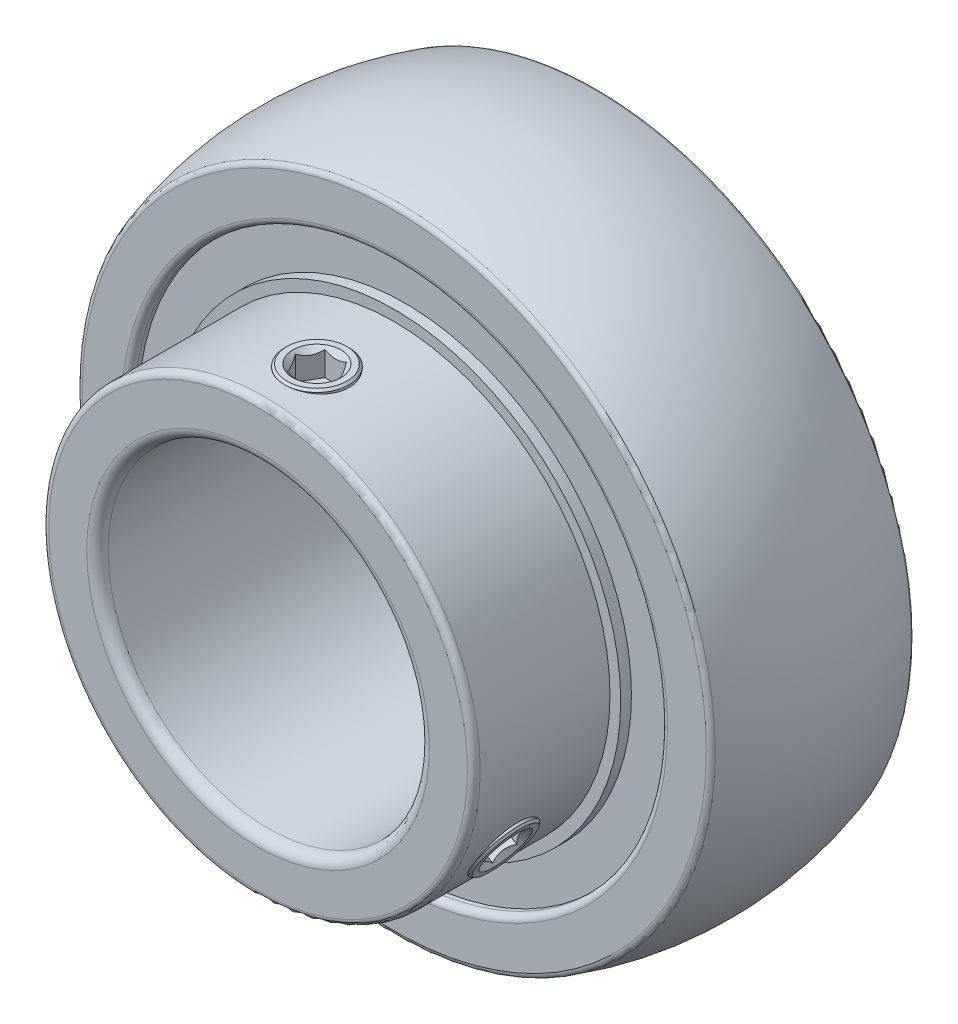
from build123d import *

# Parameters (mm, degrees)
ESBO_O1_W             = 16
ESBO_O1_H             = 4.76
ESBO_O2_R             = 3
CORTE_EXTRUS_O1_DEPTH = 50.150060066
CORTE_EXTRUS_O2_DEPTH = 2.5
PADR_OCIRCULAR1_COUNT = 2
PADR_OCIRCULAR1_ANGLE = 120


with BuildPart() as part:
    # Esboço1 → Revolução1 (revolve)
    with BuildSketch(Plane(origin=(0, 0, 0), x_dir=(0, 0, -1), z_dir=(1, 0, 0)), mode=Mode.PRIVATE) as revolu_o1_sk:
        with BuildLine():
            Line((-9.5, 29.141894242), (-9.5, 25.51))
            ThreePointArc((-9.5, 25.51), (-9.324264069, 25.085735931), (-8.9, 24.91))
            Line((-8.9, 24.91), (-8.5, 24.91))
            Line((-8.5, 24.91), (-8.5, 21.15))
            Line((-8.5, 21.15), (-9.5, 21.15))
            Line((-9.5, 21.15), (-9.5, 20.15))
            Line((-9.5, 20.15), (-21.62, 20.15))
            ThreePointArc((-21.62, 20.15), (-22.044264069, 19.974264069), (-22.22, 19.55))
            Line((-22.22, 19.55), (-22.22, 16))
            ThreePointArc((-22.22, 16), (-21.927106781, 15.292893219), (-21.22, 15))
            Line((-21.22, 15), (14.88, 15))
            ThreePointArc((14.88, 15), (15.587106781, 15.292893219), (15.88, 16))
            Line((15.88, 16), (15.88, 19.55))
            ThreePointArc((15.88, 19.55), (15.704264069, 19.974264069), (15.28, 20.15))
            Line((15.28, 20.15), (9.5, 20.15))
            Line((9.5, 20.15), (9.5, 21.15))
            Line((9.5, 21.15), (8.5, 21.15))
            Line((8.5, 21.15), (8.5, 24.91))
            Line((8.5, 24.91), (8.9, 24.91))
            ThreePointArc((8.9, 24.91), (9.324264069, 25.085735931), (9.5, 25.51))
            Line((9.5, 25.51), (9.5, 29.141894242))
            ThreePointArc((9.5, 29.141894242), (9.402349656, 29.438735536), (9.147540984, 29.619630213))
            ThreePointArc((9.147540984, 29.619630213), (0, 31), (-9.147540984, 29.619630213))
            ThreePointArc((-9.147540984, 29.619630213), (-9.402349656, 29.438735536), (-9.5, 29.141894242))
        make_face()
        with Locations((0, 22.53)):
            Rectangle(ESBO_O1_W, ESBO_O1_H, mode=Mode.SUBTRACT)
    revolve(revolu_o1_sk.sketch.rotate(Axis((0, 0, 996.83), (0, 0, -1)), 90), axis=Axis((0, 0, 996.83), (0, 0, -1)))

    # Esboço2 → Corte-extrusão1 (cut, through all)
    with BuildSketch(Plane(origin=(0, 0, 0), x_dir=(1, 0, 0), z_dir=(0, 1, 0))):
        with Locations(Location((0, -16.72, 0), (0, 0, 90))):
            Circle(ESBO_O2_R)
    corte_extrus_o1 = extrude(amount=CORTE_EXTRUS_O1_DEPTH, mode=Mode.SUBTRACT)

    # Esboço3 → Revolução2 (revolve)
    with BuildSketch(Plane(origin=(0, 0, 0), x_dir=(0, 0, -1), z_dir=(1, 0, 0)), mode=Mode.PRIVATE) as revolu_o2_sk:
        Polygon((-19.52, 20.35), (-19.72, 20.15), (-19.72, 15.6), (-19.12, 15), (-16.72, 15), (-16.72, 17.85), (-18.47, 17.85), (-18.47, 19.85), (-18.97, 20.35), align=None)
    revolu_o2 = revolve(revolu_o2_sk.sketch.rotate(Axis((0, -1000.588101223, 16.72), (0, 1, 0)), 180), axis=Axis((0, -1000.588101223, 16.72), (0, 1, 0)))

    # Esboço4 → Corte-extrusão2 (cut)
    with BuildSketch(Plane(origin=(0, 20.35, 0), x_dir=(1, 0, 0), z_dir=(0, 1, 0))):
        Polygon((1.010362971, -18.47), (2.020725942, -16.72), (1.010362971, -14.97), (-1.010362971, -14.97), (-2.020725942, -16.72), (-1.010362971, -18.47), align=None)
    corte_extrus_o2 = extrude(amount=-CORTE_EXTRUS_O2_DEPTH, mode=Mode.SUBTRACT)

    # PadrãoCircular1: Corte-extrusão1, Revolução2, Corte-extrusão2 ×2 about axis
    padr_ocircular1_axis = Axis((0, 0, 0), (0, 0, -1))
    add([corte_extrus_o1.rotate(padr_ocircular1_axis, i * PADR_OCIRCULAR1_ANGLE / (PADR_OCIRCULAR1_COUNT - 1)) for i in range(1, PADR_OCIRCULAR1_COUNT)], mode=Mode.SUBTRACT)
    add([revolu_o2.rotate(padr_ocircular1_axis, i * PADR_OCIRCULAR1_ANGLE / (PADR_OCIRCULAR1_COUNT - 1)) for i in range(1, PADR_OCIRCULAR1_COUNT)])
    add([corte_extrus_o2.rotate(padr_ocircular1_axis, i * PADR_OCIRCULAR1_ANGLE / (PADR_OCIRCULAR1_COUNT - 1)) for i in range(1, PADR_OCIRCULAR1_COUNT)], mode=Mode.SUBTRACT)


solid = part.part
